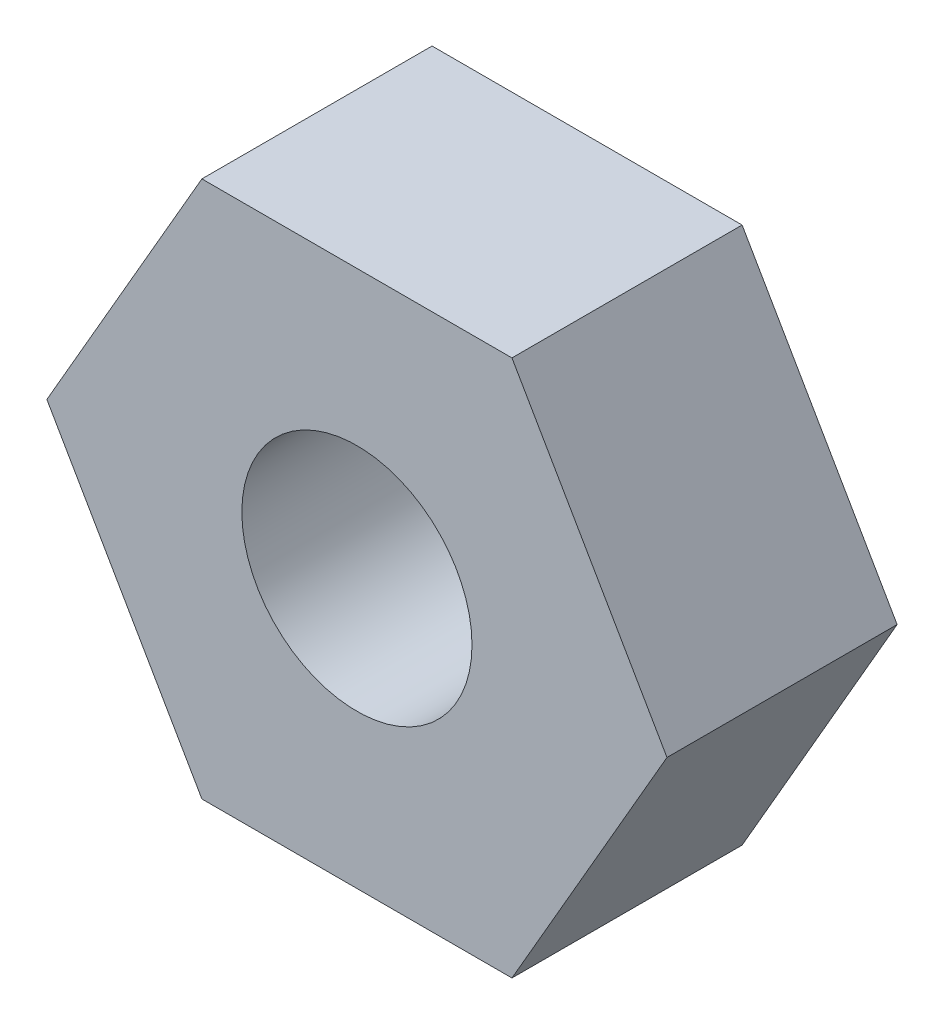
from build123d import *

# Parameters (mm, degrees)
SKETCH1_R           = 1.5
BOSS_EXTRUDE1_DEPTH = 3


with BuildPart() as part:
    # Sketch1 → Boss-Extrude1 (new body)
    with BuildSketch(Plane.XY):
        Polygon((-4.041451884, 0), (-2.020725942, -3.5), (2.020725942, -3.5), (4.041451884, 0), (2.020725942, 3.5), (-2.020725942, 3.5), align=None)
        Circle(SKETCH1_R, mode=Mode.SUBTRACT)
    extrude(amount=BOSS_EXTRUDE1_DEPTH)


solid = part.part
